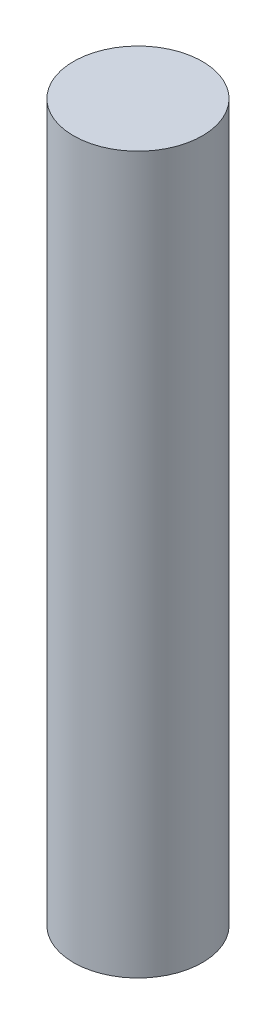
from build123d import *

# Parameters (mm, degrees)
SKETCH1_R           = 9
BOSS_EXTRUDE1_DEPTH = 100


with BuildPart() as part:
    # Sketch1 → Boss-Extrude1 (new body)
    with BuildSketch(Plane(origin=(0, 0, 0), x_dir=(1, 0, 0), z_dir=(0, 1, 0))):
        with Locations(Location((0, 0, 0), (0, 0, 270))):
            Circle(SKETCH1_R)
    extrude(amount=BOSS_EXTRUDE1_DEPTH)


solid = part.part
